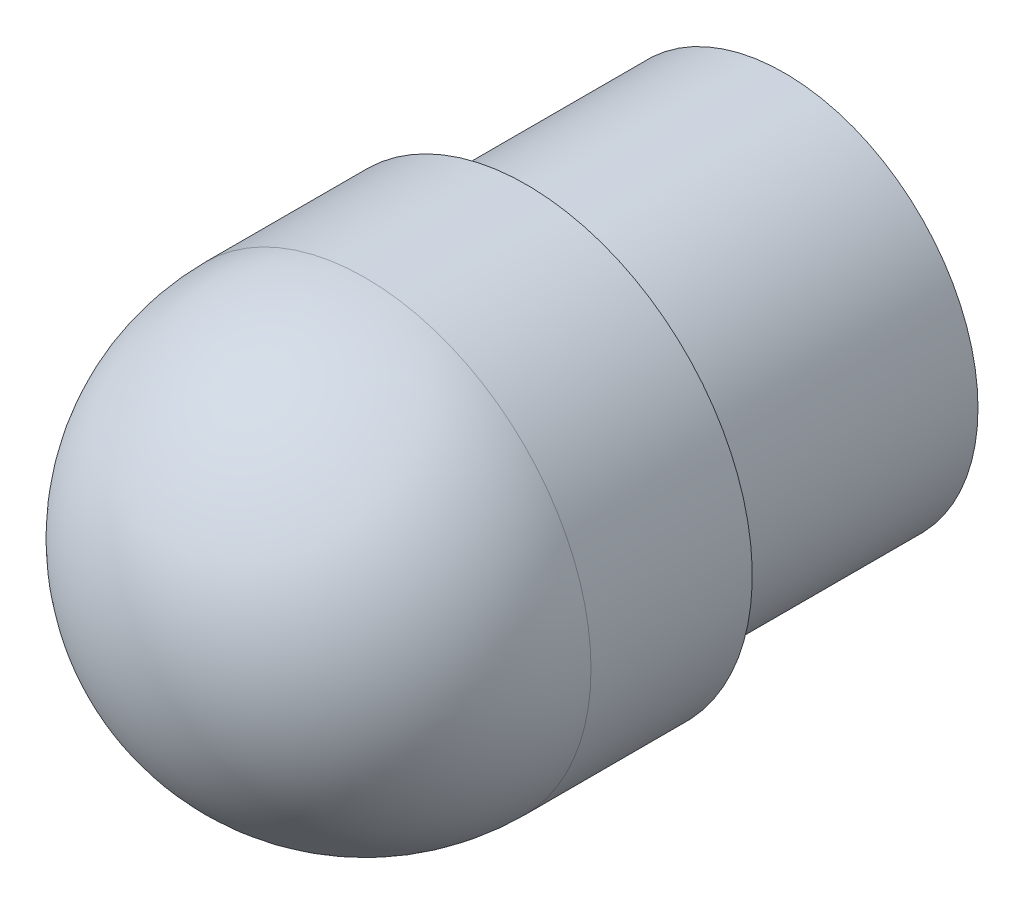
from build123d import *

# Parameters (mm, degrees)
SKETCH7_R           = 381
BOSS_EXTRUDE3_DEPTH = 508
SKETCH8_R           = 444.5
BOSS_EXTRUDE4_DEPTH = 317.5


with BuildPart() as part:
    # Sketch7 → Boss-Extrude3 (new body)
    with BuildSketch(Plane.XY):
        Circle(SKETCH7_R)
    extrude(amount=BOSS_EXTRUDE3_DEPTH)

    # Sketch8 → Boss-Extrude4 (add)
    with BuildSketch(Plane.XY.offset(508)):
        with Locations(Location((0, 0, 0), (0, 0, 180))):
            Circle(SKETCH8_R)
    extrude(amount=BOSS_EXTRUDE4_DEPTH)

    # Sketch9 → Revolve1 (revolve)
    with BuildSketch(Plane.XY.offset(825.5)):
        with BuildLine():
            Line((0, 444.5), (0, -444.5))
            ThreePointArc((0, -444.5), (-444.5, 0), (0, 444.5))
        make_face()
    revolve(axis=Axis((0, 444.5, 825.5), (0, -1, 0)))


solid = part.part
